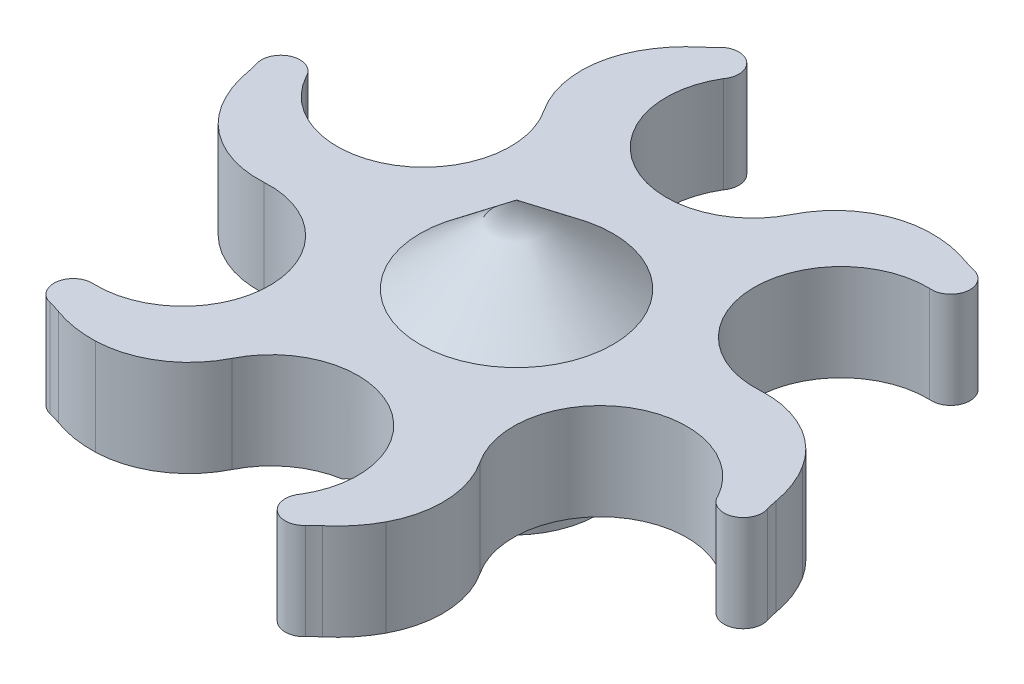
from build123d import *
from build123d.topology import SkipClean

# Parameters (mm, degrees)
BOSS_EXTRUDE1_DEPTH     = 10
BOSS_EXTRUDE2_START     = -10
BOSS_EXTRUDE2_DEPTH     = 10
FILLET1_R               = 10
SKETCH3_R               = 9
BOSS_EXTRUDE3_DEPTH     = 6
CUT_EXTRUDE1_DEPTH      = 48.881238758
CUT_EXTRUDE1_DEPTH_BACK = 48.881238758
SKETCH5_R               = 1.65
SKETCH10_R              = 2.85
CUT_EXTRUDE4_DEPTH      = 57.470408851
CUT_EXTRUDE5_DEPTH      = 16
FILLET2_R               = 10


with BuildPart() as part:
    # Sketch1 → Boss-Extrude1 (new body)
    with BuildSketch(Plane(origin=(0, 0, 0), x_dir=(1, 0, 0), z_dir=(0, 1, 0))):
        with BuildLine():
            ThreePointArc((-24.674173686, 4.02307754), (-25, 0), (-24.674173686, -4.02307754))
            ThreePointArc((-24.674173686, -4.02307754), (-13.856406461, -8), (-15.821174195, -19.35692246))
            ThreePointArc((-15.821174195, -19.35692246), (-12.5, -21.650635095), (-8.852999492, -23.38))
            ThreePointArc((-8.852999492, -23.38), (0, -16), (8.852999492, -23.38))
            ThreePointArc((8.852999492, -23.38), (12.5, -21.650635095), (15.821174195, -19.35692246))
            ThreePointArc((15.821174195, -19.35692246), (13.856406461, -8), (24.674173686, -4.02307754))
            ThreePointArc((24.674173686, -4.02307754), (25, 0), (24.674173686, 4.02307754))
            ThreePointArc((24.674173686, 4.02307754), (13.856406461, 8), (15.821174195, 19.35692246))
            ThreePointArc((15.821174195, 19.35692246), (12.5, 21.650635095), (8.852999492, 23.38))
            ThreePointArc((8.852999492, 23.38), (0, 16), (-8.852999492, 23.38))
            ThreePointArc((-8.852999492, 23.38), (-12.5, 21.650635095), (-15.821174195, 19.35692246))
            ThreePointArc((-15.821174195, 19.35692246), (-13.856406461, 8), (-24.674173686, 4.02307754))
        make_face()
    extrude(amount=BOSS_EXTRUDE1_DEPTH)

    # Sketch2 → Boss-Extrude2 (add)
    with SkipClean():  # the faces are left unmerged after this step: merging them gives an invalid solid
        with BuildSketch(Plane(origin=(0, 10, 0), x_dir=(1, 0, 0), z_dir=(0, 1, 0)).offset(BOSS_EXTRUDE2_START)):
            with BuildLine():
                ThreePointArc((8.852999492, 23.38), (15.14785668, 26.382248512), (22.063864396, 25.48360486))
                ThreePointArc((22.063864396, 25.48360486), (24.060166166, 23.362034963), (21.821174195, 21.4983841))
                ThreePointArc((21.821174195, 21.4983841), (18.625356021, 20.976301465), (15.821174195, 19.35692246))
                ThreePointArc((15.821174195, 19.35692246), (12.5, 21.650635095), (8.852999492, 23.38))
            make_face()
            with BuildLine():
                ThreePointArc((24.674173686, 4.02307754), (30.42162576, 0.072695558), (33.101381387, -6.366064642))
                ThreePointArc((33.101381387, -6.366064642), (32.262198845, -9.155697638), (29.528733868, -8.148499143))
                ThreePointArc((29.528733868, -8.148499143), (27.478687957, -5.641880736), (24.674173686, -4.02307754))
                ThreePointArc((24.674173686, -4.02307754), (25, 0), (24.674173686, 4.02307754))
            make_face()
            with BuildLine():
                ThreePointArc((15.821174195, -19.35692246), (15.27376908, -26.309552953), (11.037516991, -31.849669502))
                ThreePointArc((11.037516991, -31.849669502), (8.202032679, -32.517732601), (7.707559674, -29.646883243))
                ThreePointArc((7.707559674, -29.646883243), (8.853331936, -26.618182201), (8.852999492, -23.38))
                ThreePointArc((8.852999492, -23.38), (12.5, -21.650635095), (15.821174195, -19.35692246))
            make_face()
            with BuildLine():
                ThreePointArc((-8.852999492, -23.38), (-15.14785668, -26.382248512), (-22.063864396, -25.48360486))
                ThreePointArc((-22.063864396, -25.48360486), (-24.060166166, -23.362034963), (-21.821174195, -21.4983841))
                ThreePointArc((-21.821174195, -21.4983841), (-18.625356021, -20.976301465), (-15.821174195, -19.35692246))
                ThreePointArc((-15.821174195, -19.35692246), (-12.5, -21.650635095), (-8.852999492, -23.38))
            make_face()
            with BuildLine():
                ThreePointArc((-24.674173686, -4.02307754), (-30.42162576, -0.072695558), (-33.101381387, 6.366064642))
                ThreePointArc((-33.101381387, 6.366064642), (-32.262198845, 9.155697638), (-29.528733868, 8.148499143))
                ThreePointArc((-29.528733868, 8.148499143), (-27.478687957, 5.641880736), (-24.674173686, 4.02307754))
                ThreePointArc((-24.674173686, 4.02307754), (-25, 0), (-24.674173686, -4.02307754))
            make_face()
            with BuildLine():
                ThreePointArc((-15.821174195, 19.35692246), (-15.27376908, 26.309552953), (-11.037516991, 31.849669502))
                ThreePointArc((-11.037516991, 31.849669502), (-8.202032679, 32.517732601), (-7.707559674, 29.646883243))
                ThreePointArc((-7.707559674, 29.646883243), (-8.853331936, 26.618182201), (-8.852999492, 23.38))
                ThreePointArc((-8.852999492, 23.38), (-12.5, 21.650635095), (-15.821174195, 19.35692246))
            make_face()
        extrude(amount=BOSS_EXTRUDE2_DEPTH)

    # Fillet1
    fillet1_edges = [part.edges().sort_by_distance(p)[0] for p in [
        (24.674173686, 5, -4.02307754),
        (15.821174195, 5, 19.35692246),
        (-8.852999492, 5, 23.38),
        (-24.674173686, 5, 4.02307754),
        (-15.821174195, 5, -19.35692246),
        (8.852999492, 5, -23.38),
    ]]
    fillet(fillet1_edges, radius=FILLET1_R)

    # Sketch6 → Revolve1 (revolve)
    with SkipClean():  # the faces are left unmerged after this step: merging them gives an invalid solid
        with BuildSketch(Plane.XY, mode=Mode.PRIVATE) as revolve1_sk:
            Polygon((0.471378797, 10), (0.471378797, 18), (10.471378797, 10), align=None)
        revolve(revolve1_sk.sketch.rotate(Axis((0.471378797, 10, 0), (0, 1, 0)), 90), axis=Axis((0.471378797, 10, 0), (0, 1, 0)))

    # Sketch10 → Cut-Extrude4 (cut, through all)
    with SkipClean():  # the faces are left unmerged after this step: merging them gives an invalid solid
        with BuildSketch(Plane.XY.offset(9)):
            with Locations((0, -2.436)):
                Circle(SKETCH10_R)
        cut_extrude4 = extrude(amount=CUT_EXTRUDE4_DEPTH, mode=Mode.SUBTRACT)

    # Mirror1: Cut-Extrude4 across plane
    with SkipClean():  # the faces are left unmerged after this step: merging them gives an invalid solid
        add(cut_extrude4.mirror(Plane.XY), mode=Mode.SUBTRACT)

    # Sketch11 → Cut-Extrude5 (cut)
    with SkipClean():  # the faces are left unmerged after this step: merging them gives an invalid solid
        with BuildSketch(Plane.XZ.offset(6)):
            with BuildLine():
                Line((-1.80641219, 2.55), (1.80641219, 2.55))
                ThreePointArc((1.80641219, 2.55), (0, -3.125), (-1.80641219, 2.55))
            make_face()
        extrude(amount=-CUT_EXTRUDE5_DEPTH, mode=Mode.SUBTRACT)

    # Fillet2
    fillet2_edges = [part.edges().sort_by_distance(p)[0] for p in [
        (22.063864396, 5, -25.48360486),
        (33.101381387, 5, 6.366064642),
        (11.037516991, 5, 31.849669502),
        (-22.063864396, 5, 25.48360486),
        (-33.101381387, 5, -6.366064642),
        (-11.037516991, 5, -31.849669502),
    ]]
    fillet(fillet2_edges, radius=FILLET2_R)


with BuildPart() as body_2:
    # Sketch3 → Boss-Extrude3 (new body)
    with BuildSketch(Plane.XZ):
        with Locations(Location((0, 0, 0), (0, 0, 270))):
            Circle(SKETCH3_R)
    extrude(amount=BOSS_EXTRUDE3_DEPTH)

    # Sketch5 → Cut-Extrude1 (cut, two sides: drawn at the far end of the back side and taken through both)
    with BuildSketch(Plane.XY.offset(-CUT_EXTRUDE1_DEPTH_BACK)):
        with Locations(Location((0, -2.436, 0), (0, 0, 269.999999982))):
            Circle(SKETCH5_R)
    extrude(amount=CUT_EXTRUDE1_DEPTH + CUT_EXTRUDE1_DEPTH_BACK, mode=Mode.SUBTRACT)


solid = Compound([part.part, body_2.part])
